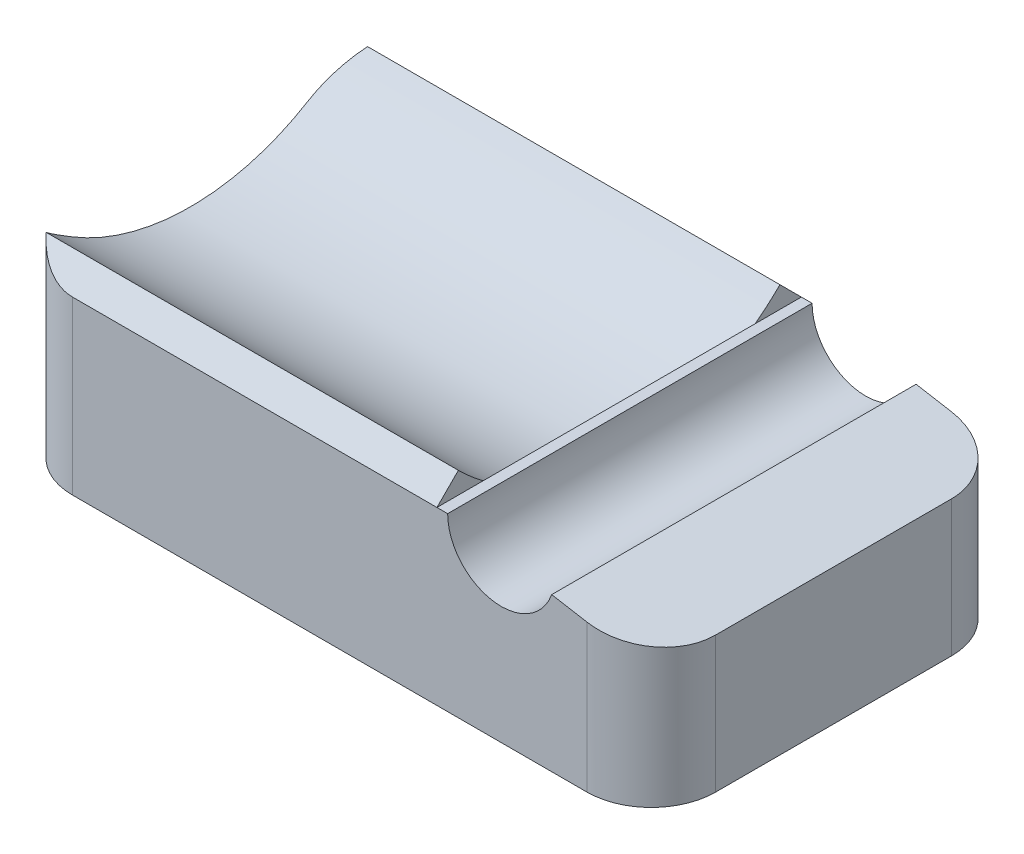
from build123d import *

# Parameters (mm, degrees)
SKETCH1_W           = 60
SKETCH1_H           = 34
BOSS_EXTRUDE1_DEPTH = 16
BOSS_EXTRUDE2_DEPTH = 40
CUT_EXTRUDE2_DEPTH  = 40
SKETCH2_R           = 5
CUT_EXTRUDE1_DEPTH  = 72.274118725
FILLET1_R           = 6
CUT_EXTRUDE3_DEPTH  = 72.274118798


with BuildPart() as part:
    # Sketch1 → Boss-Extrude1 (new body)
    with BuildSketch(Plane(origin=(0, 0, 0), x_dir=(1, 0, 0), z_dir=(0, 1, 0))):
        with Locations((30, 17)):
            Rectangle(SKETCH1_W, SKETCH1_H)
    extrude(amount=BOSS_EXTRUDE1_DEPTH)

    # Sketch3 → Boss-Extrude2 (add)
    with BuildSketch(Plane.ZY):
        with BuildLine():
            Line((-34, 16), (-32, 18))
            ThreePointArc((-32, 18), (-30.88035776, 16.958314663), (-29.68857754, 16))
            Line((-29.68857754, 16), (-34, 16))
        make_face()
        with BuildLine():
            Line((-2, 18), (0, 16))
            Line((0, 16), (-4.31142246, 16))
            ThreePointArc((-4.31142246, 16), (-3.11964224, 16.958314663), (-2, 18))
        make_face()
    extrude(amount=-BOSS_EXTRUDE2_DEPTH)

    # Sketch4 → Cut-Extrude2 (cut)
    with BuildSketch(Plane.ZY):
        with BuildLine():
            Line((-19.472144861, 33), (-38.213203436, 33))
            ThreePointArc((-38.213203436, 33), (-17, 11.786796564), (4.213203436, 33))
            Line((4.213203436, 33), (-19.472144861, 33))
        make_face()
    extrude(amount=-CUT_EXTRUDE2_DEPTH, mode=Mode.SUBTRACT)

    # Sketch2 → Cut-Extrude1 (cut, through all)
    with BuildSketch(Plane.XY):
        with Locations((46, 16)):
            Circle(SKETCH2_R)
    extrude(amount=-CUT_EXTRUDE1_DEPTH, mode=Mode.SUBTRACT)

    # Fillet1
    fillet1_edges = [part.edges().sort_by_distance(p)[0] for p in [
        (0, 8, -34),
        (60, 8, -34),
        (60, 8, 0),
        (0, 8, 0),
    ]]
    fillet(fillet1_edges, radius=FILLET1_R)

    # Sketch5 → Cut-Extrude3 (cut, through all)
    with BuildSketch(Plane.XY):
        Polygon((50.705913613, 14.310509822), (60, 12.692705636), (60, 16), (51, 16), align=None)
    extrude(amount=-CUT_EXTRUDE3_DEPTH, mode=Mode.SUBTRACT)


solid = part.part
